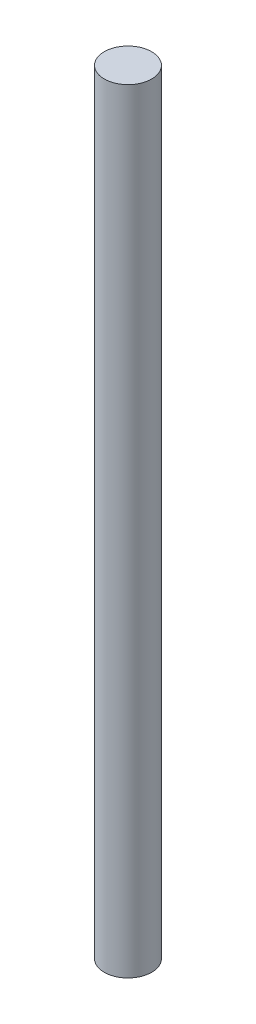
from build123d import *

# Parameters (mm, degrees)
SKETCH1_R           = 1.5
BOSS_EXTRUDE1_DEPTH = 49


with BuildPart() as part:
    # Sketch1 → Boss-Extrude1 (new body)
    with BuildSketch(Plane(origin=(0, 0, 0), x_dir=(1, 0, 0), z_dir=(0, 1, 0))):
        with Locations(Location((0, 0, 0), (0, 0, 270))):
            Circle(SKETCH1_R)
    extrude(amount=BOSS_EXTRUDE1_DEPTH)


solid = part.part
